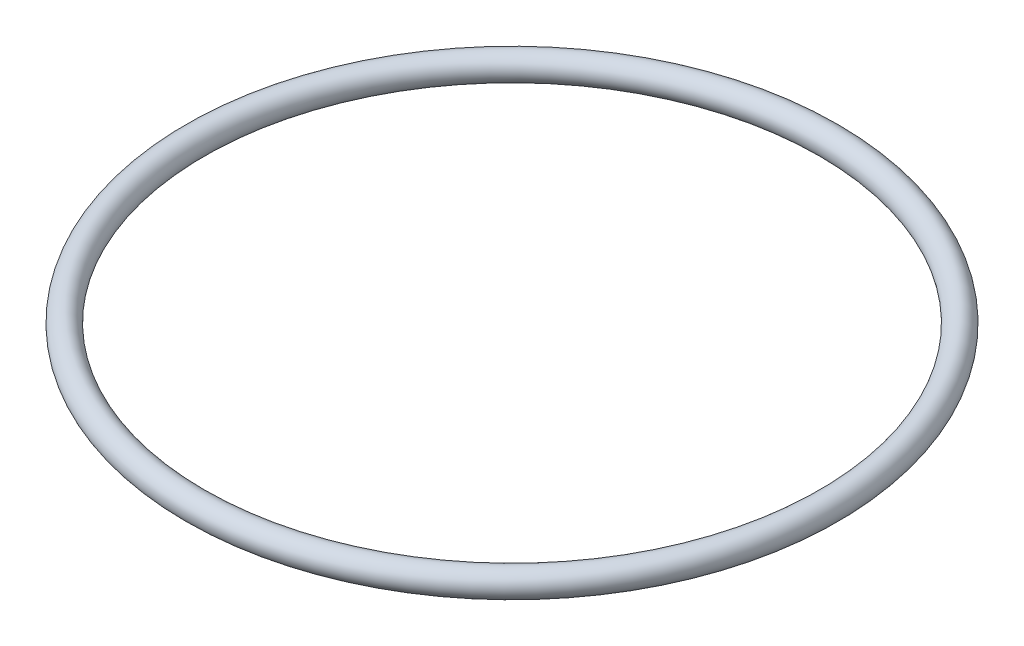
from build123d import *

# Parameters (mm, degrees)
SKETCH1_R = 0.79375


with BuildPart() as part:
    # Sketch1 → Revolve1 (revolve)
    with BuildSketch(Plane.XY, mode=Mode.PRIVATE) as revolve1_sk:
        with Locations((-19.43, 0.601464435)):
            Circle(SKETCH1_R)
    revolve(revolve1_sk.sketch.rotate(Axis((0, -4.680962343, 0), (0, 1, 0)), 270), axis=Axis((0, -4.680962343, 0), (0, 1, 0)))


solid = part.part
